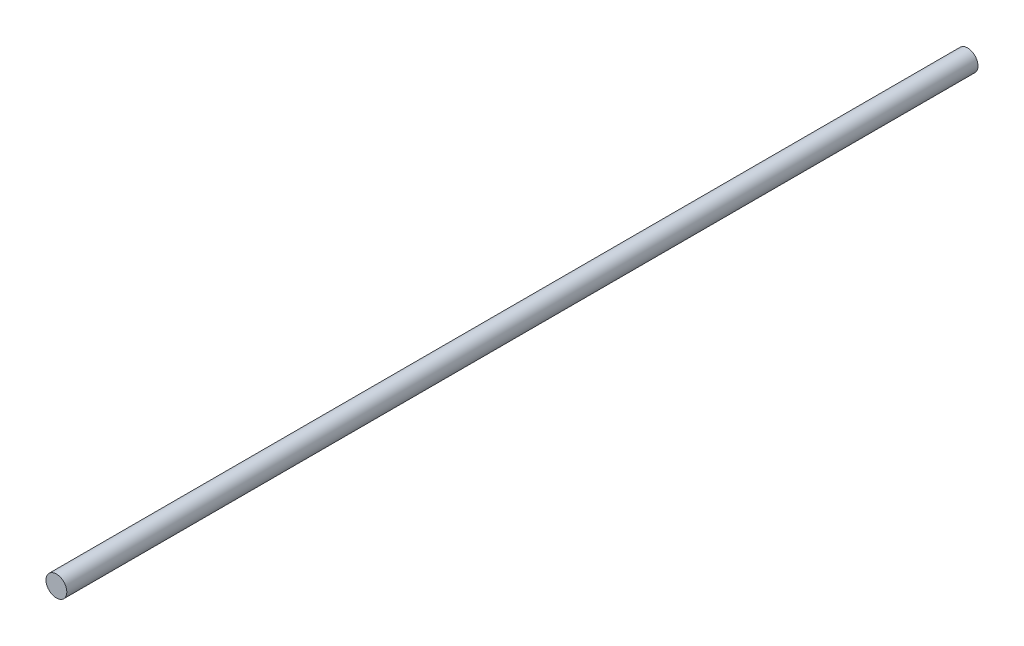
from build123d import *

# Parameters (mm, degrees)
SKETCH1_R           = 6
BOSS_EXTRUDE1_DEPTH = 525


with BuildPart() as part:
    # Sketch1 → Boss-Extrude1 (new body)
    with BuildSketch(Plane.XY):
        Circle(SKETCH1_R)
    extrude(amount=BOSS_EXTRUDE1_DEPTH)


solid = part.part
